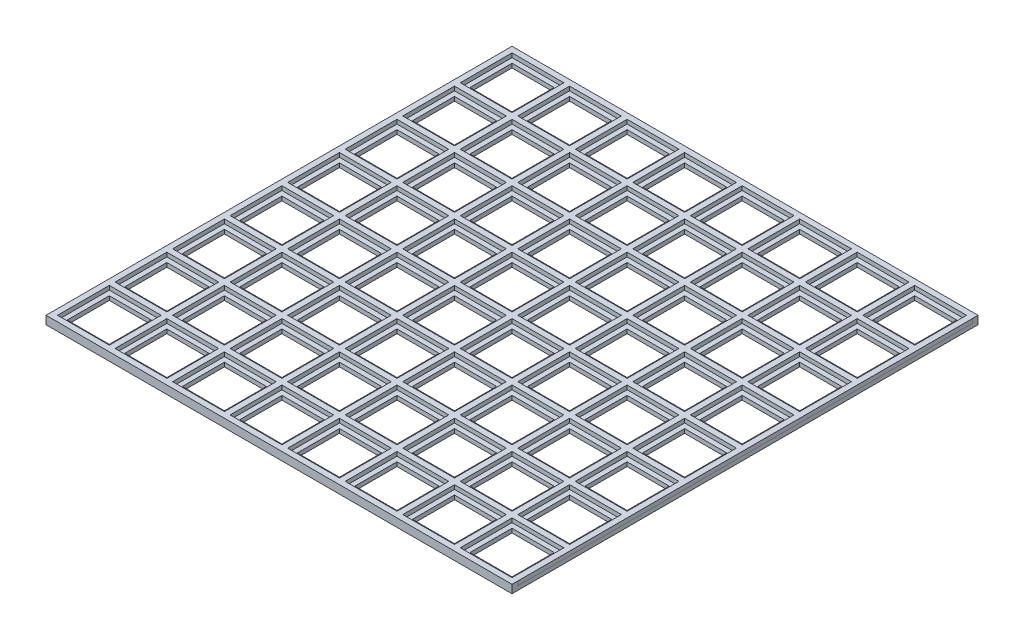
from build123d import *

# Parameters (mm, degrees)
BOSS_EXTRUDE3_DEPTH = 288.04
SKETCH7_W           = 3.556
SKETCH7_H           = 280.92
SKETCH7_W_2         = 288.016259663
SKETCH7_H_2         = 3.556
BOSS_EXTRUDE4_DEPTH = 2.54
SKETCH8_W           = 26
SKETCH8_H           = 26
CUT_EXTRUDE1_DEPTH  = 2.54


with BuildPart() as part:
    # Sketch5 → Boss-Extrude3 (new body)
    with BuildSketch(Plane(origin=(0, 0, 0), x_dir=(0, 0, -1), z_dir=(1, 0, 0))):
        Polygon((-23.419192369, -2.255434783), (-23.419192369, 2.824565217), (-19.863192369, 2.824565217), (-19.863192369, 0.284565217), (261.056807631, 0.284565217), (261.056807631, 2.824565217), (264.612807631, 2.824565217), (264.612807631, -2.255434783), (261.052807631, -2.255434783), (-19.863192369, -2.255434783), align=None)
    extrude(amount=BOSS_EXTRUDE3_DEPTH)

    # Sketch7 → Boss-Extrude4 (add)
    with BuildSketch(Plane(origin=(0, 0.284565217, 0), x_dir=(1, 0, 0), z_dir=(0, 1, 0))):
        with Locations((1.801740337, 120.596807631)):
            Rectangle(SKETCH7_W, SKETCH7_H)
        with Locations((37.361740337, 120.596807631)):
            Rectangle(SKETCH7_W, SKETCH7_H)
        with Locations((72.921740337, 120.596807631)):
            Rectangle(SKETCH7_W, SKETCH7_H)
        with Locations((108.481740337, 120.596807631)):
            Rectangle(SKETCH7_W, SKETCH7_H)
        with Locations((144.041740337, 120.596807631)):
            Rectangle(SKETCH7_W, SKETCH7_H)
        with Locations((179.601740337, 120.596807631)):
            Rectangle(SKETCH7_W, SKETCH7_H)
        with Locations((215.161740337, 120.596807631)):
            Rectangle(SKETCH7_W, SKETCH7_H)
        with Locations((250.721740337, 120.596807631)):
            Rectangle(SKETCH7_W, SKETCH7_H)
        with Locations((286.281740337, 120.596807631)):
            Rectangle(SKETCH7_W, SKETCH7_H)
        with Locations((144.041870168, 13.918807631)):
            Rectangle(SKETCH7_W_2, SKETCH7_H_2)
        with Locations((144.041870168, 49.478807631)):
            Rectangle(SKETCH7_W_2, SKETCH7_H_2)
        with Locations((144.041870168, 85.038807631)):
            Rectangle(SKETCH7_W_2, SKETCH7_H_2)
        with Locations((144.041870168, 120.598807631)):
            Rectangle(SKETCH7_W_2, SKETCH7_H_2)
        with Locations((144.041870168, 156.158807631)):
            Rectangle(SKETCH7_W_2, SKETCH7_H_2)
        with Locations((144.041870168, 191.718807631)):
            Rectangle(SKETCH7_W_2, SKETCH7_H_2)
        with Locations((144.041870168, 227.278807631)):
            Rectangle(SKETCH7_W_2, SKETCH7_H_2)
    extrude(amount=BOSS_EXTRUDE4_DEPTH)

    # Sketch8 → Cut-Extrude1 (cut)
    with BuildSketch(Plane(origin=(0, 0.284565217, 0), x_dir=(1, 0, 0), z_dir=(0, 1, 0))):
        with Locations((19.579740337, -3.863192369)):
            Rectangle(SKETCH8_W, SKETCH8_H)
        with Locations((55.139740337, -3.863192369)):
            Rectangle(SKETCH8_W, SKETCH8_H)
        with Locations((90.699740337, -3.863192369)):
            Rectangle(SKETCH8_W, SKETCH8_H)
        with Locations((126.259740337, -3.863192369)):
            Rectangle(SKETCH8_W, SKETCH8_H)
        with Locations((161.819740337, -3.863192369)):
            Rectangle(SKETCH8_W, SKETCH8_H)
        with Locations((197.379740337, -3.863192369)):
            Rectangle(SKETCH8_W, SKETCH8_H)
        with Locations((232.939740337, -3.863192369)):
            Rectangle(SKETCH8_W, SKETCH8_H)
        with Locations((268.499740337, -3.863192369)):
            Rectangle(SKETCH8_W, SKETCH8_H)
        with Locations((55.139740337, 31.696807631)):
            Rectangle(SKETCH8_W, SKETCH8_H)
        with Locations((90.699740337, 31.696807631)):
            Rectangle(SKETCH8_W, SKETCH8_H)
        with Locations((126.259740337, 31.696807631)):
            Rectangle(SKETCH8_W, SKETCH8_H)
        with Locations((161.819740337, 31.696807631)):
            Rectangle(SKETCH8_W, SKETCH8_H)
        with Locations((197.379740337, 31.696807631)):
            Rectangle(SKETCH8_W, SKETCH8_H)
        with Locations((232.939740337, 31.696807631)):
            Rectangle(SKETCH8_W, SKETCH8_H)
        with Locations((268.499740337, 31.696807631)):
            Rectangle(SKETCH8_W, SKETCH8_H)
        with Locations((55.139740337, 67.256807631)):
            Rectangle(SKETCH8_W, SKETCH8_H)
        with Locations((90.699740337, 67.256807631)):
            Rectangle(SKETCH8_W, SKETCH8_H)
        with Locations((126.259740337, 67.256807631)):
            Rectangle(SKETCH8_W, SKETCH8_H)
        with Locations((161.819740337, 67.256807631)):
            Rectangle(SKETCH8_W, SKETCH8_H)
        with Locations((197.379740337, 67.256807631)):
            Rectangle(SKETCH8_W, SKETCH8_H)
        with Locations((232.939740337, 67.256807631)):
            Rectangle(SKETCH8_W, SKETCH8_H)
        with Locations((268.499740337, 67.256807631)):
            Rectangle(SKETCH8_W, SKETCH8_H)
        with Locations((55.139740337, 102.816807631)):
            Rectangle(SKETCH8_W, SKETCH8_H)
        with Locations((90.699740337, 102.816807631)):
            Rectangle(SKETCH8_W, SKETCH8_H)
        with Locations((126.259740337, 102.816807631)):
            Rectangle(SKETCH8_W, SKETCH8_H)
        with Locations((161.819740337, 102.816807631)):
            Rectangle(SKETCH8_W, SKETCH8_H)
        with Locations((197.379740337, 102.816807631)):
            Rectangle(SKETCH8_W, SKETCH8_H)
        with Locations((232.939740337, 102.816807631)):
            Rectangle(SKETCH8_W, SKETCH8_H)
        with Locations((268.499740337, 102.816807631)):
            Rectangle(SKETCH8_W, SKETCH8_H)
        with Locations((55.139740337, 138.376807631)):
            Rectangle(SKETCH8_W, SKETCH8_H)
        with Locations((90.699740337, 138.376807631)):
            Rectangle(SKETCH8_W, SKETCH8_H)
        with Locations((126.259740337, 138.376807631)):
            Rectangle(SKETCH8_W, SKETCH8_H)
        with Locations((161.819740337, 138.376807631)):
            Rectangle(SKETCH8_W, SKETCH8_H)
        with Locations((197.379740337, 138.376807631)):
            Rectangle(SKETCH8_W, SKETCH8_H)
        with Locations((232.939740337, 138.376807631)):
            Rectangle(SKETCH8_W, SKETCH8_H)
        with Locations((268.499740337, 138.376807631)):
            Rectangle(SKETCH8_W, SKETCH8_H)
        with Locations((55.139740337, 173.936807631)):
            Rectangle(SKETCH8_W, SKETCH8_H)
        with Locations((90.699740337, 173.936807631)):
            Rectangle(SKETCH8_W, SKETCH8_H)
        with Locations((126.259740337, 173.936807631)):
            Rectangle(SKETCH8_W, SKETCH8_H)
        with Locations((161.819740337, 173.936807631)):
            Rectangle(SKETCH8_W, SKETCH8_H)
        with Locations((197.379740337, 173.936807631)):
            Rectangle(SKETCH8_W, SKETCH8_H)
        with Locations((232.939740337, 173.936807631)):
            Rectangle(SKETCH8_W, SKETCH8_H)
        with Locations((268.499740337, 173.936807631)):
            Rectangle(SKETCH8_W, SKETCH8_H)
        with Locations((55.139740337, 209.496807631)):
            Rectangle(SKETCH8_W, SKETCH8_H)
        with Locations((90.699740337, 209.496807631)):
            Rectangle(SKETCH8_W, SKETCH8_H)
        with Locations((126.259740337, 209.496807631)):
            Rectangle(SKETCH8_W, SKETCH8_H)
        with Locations((161.819740337, 209.496807631)):
            Rectangle(SKETCH8_W, SKETCH8_H)
        with Locations((197.379740337, 209.496807631)):
            Rectangle(SKETCH8_W, SKETCH8_H)
        with Locations((232.939740337, 209.496807631)):
            Rectangle(SKETCH8_W, SKETCH8_H)
        with Locations((268.499740337, 209.496807631)):
            Rectangle(SKETCH8_W, SKETCH8_H)
        with Locations((55.139740337, 245.056807631)):
            Rectangle(SKETCH8_W, SKETCH8_H)
        with Locations((90.699740337, 245.056807631)):
            Rectangle(SKETCH8_W, SKETCH8_H)
        with Locations((126.259740337, 245.056807631)):
            Rectangle(SKETCH8_W, SKETCH8_H)
        with Locations((161.819740337, 245.056807631)):
            Rectangle(SKETCH8_W, SKETCH8_H)
        with Locations((197.379740337, 245.056807631)):
            Rectangle(SKETCH8_W, SKETCH8_H)
        with Locations((232.939740337, 245.056807631)):
            Rectangle(SKETCH8_W, SKETCH8_H)
        with Locations((268.499740337, 245.056807631)):
            Rectangle(SKETCH8_W, SKETCH8_H)
        with Locations((19.579740337, 31.696807631)):
            Rectangle(SKETCH8_W, SKETCH8_H)
        with Locations((19.579740337, 67.256807631)):
            Rectangle(SKETCH8_W, SKETCH8_H)
        with Locations((19.579740337, 102.816807631)):
            Rectangle(SKETCH8_W, SKETCH8_H)
        with Locations((19.579740337, 138.376807631)):
            Rectangle(SKETCH8_W, SKETCH8_H)
        with Locations((19.579740337, 173.936807631)):
            Rectangle(SKETCH8_W, SKETCH8_H)
        with Locations((19.579740337, 209.496807631)):
            Rectangle(SKETCH8_W, SKETCH8_H)
        with Locations((19.579740337, 245.056807631)):
            Rectangle(SKETCH8_W, SKETCH8_H)
    extrude(amount=-CUT_EXTRUDE1_DEPTH, mode=Mode.SUBTRACT)


solid = part.part
